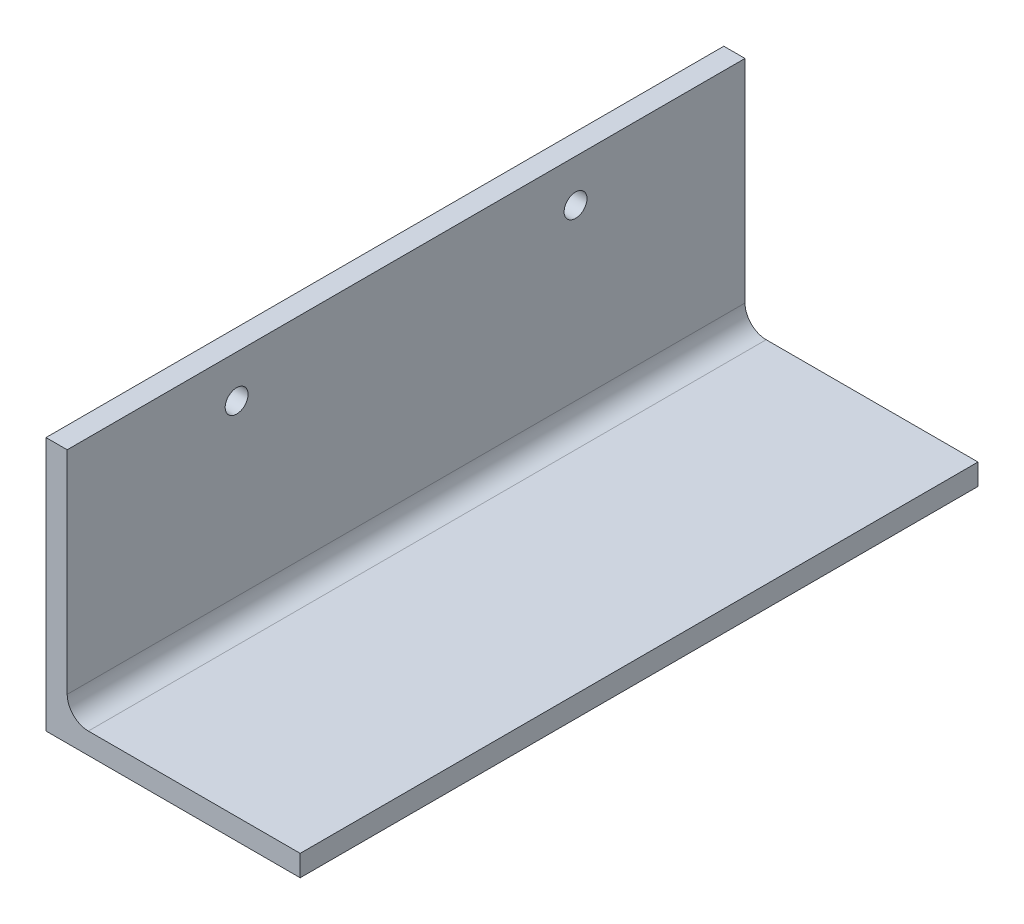
from build123d import *

# Parameters (mm, degrees)
BOSS_EXTRUDE1_DEPTH = 203.2
SKETCH2_R           = 3.429
CUT_EXTRUDE1_DEPTH  = 228.981803002


with BuildPart() as part:
    # Sketch1 → Boss-Extrude1 (new body)
    with BuildSketch(Plane.XY):
        with BuildLine():
            Line((0, 0), (76.2, 0))
            Line((76.2, 0), (76.2, 6.35))
            Line((76.2, 6.35), (12.7, 6.35))
            ThreePointArc((12.7, 6.35), (8.209871939, 8.209871939), (6.35, 12.7))
            Line((6.35, 12.7), (6.35, 76.2))
            Line((6.35, 76.2), (0, 76.2))
            Line((0, 76.2), (0, 0))
        make_face()
    extrude(amount=BOSS_EXTRUDE1_DEPTH)

    # Sketch2 → Cut-Extrude1 (cut, through all)
    with BuildSketch(Plane(origin=(6.35, 0, 0), x_dir=(0, 0, -1), z_dir=(1, 0, 0))):
        with Locations(Location((-50.8, 63.5, 0), (0, 0, 90))):
            Circle(SKETCH2_R)
        with Locations(Location((-152.4, 63.5, 0), (0, 0, 90))):
            Circle(SKETCH2_R)
    extrude(amount=-CUT_EXTRUDE1_DEPTH, mode=Mode.SUBTRACT)


solid = part.part
